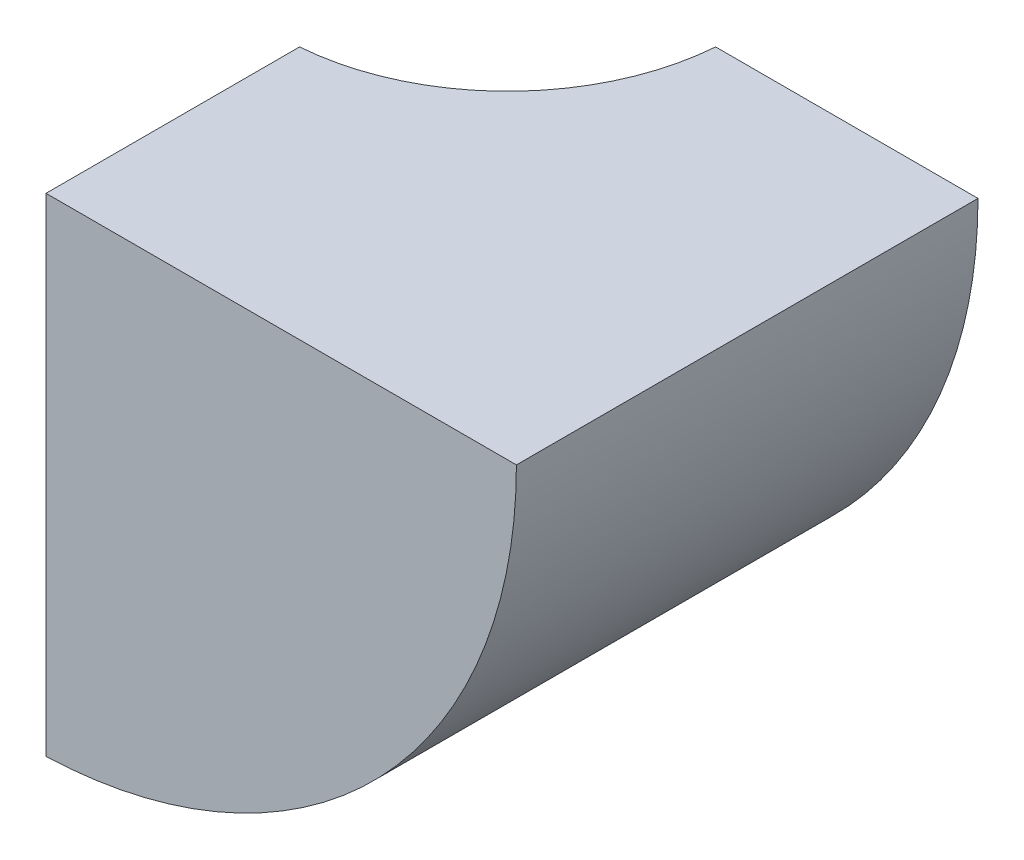
from build123d import *

# Parameters (mm, degrees)
SKETCH1_R           = 16.6
BOSS_EXTRUDE1_DEPTH = 16.3
CUT_EXTRUDE1_DEPTH  = 29.579888033
SKETCH3_R           = 7.7
CUT_EXTRUDE2_DEPTH  = 29.579888033
SKETCH4_W           = 0.6
SKETCH4_H           = 9.511954595
SKETCH4_W_2         = 10.341543893
SKETCH4_H_2         = 0.6
CUT_EXTRUDE3_DEPTH  = 29.579888207


with BuildPart() as part:
    # Sketch1 → Boss-Extrude1 (new body)
    with BuildSketch(Plane.XY):
        Circle(SKETCH1_R)
    extrude(amount=BOSS_EXTRUDE1_DEPTH)

    # Sketch2 → Cut-Extrude1 (cut, through all)
    with BuildSketch(Plane.XY.offset(16.3)):
        with BuildLine():
            Line((0, 0), (16.6, 0))
            ThreePointArc((16.6, 0), (-11.737972568, 11.737972568), (0, -16.6))
            Line((0, -16.6), (0, 0))
        make_face()
    extrude(amount=-CUT_EXTRUDE1_DEPTH, mode=Mode.SUBTRACT)

    # Sketch3 → Cut-Extrude2 (cut, through all)
    with BuildSketch(Plane(origin=(0, 0, 0), x_dir=(1, 0, 0), z_dir=(0, 1, 0))):
        Circle(SKETCH3_R)
    extrude(amount=-CUT_EXTRUDE2_DEPTH, mode=Mode.SUBTRACT)

    # Sketch4 → Cut-Extrude3 (cut, through all)
    with BuildSketch(Plane(origin=(0, 0, 0), x_dir=(1, 0, 0), z_dir=(0, 1, 0))):
        with Locations((0.3, -11.544022703)):
            Rectangle(SKETCH4_W, SKETCH4_H)
        with Locations((11.429228054, -0.3)):
            Rectangle(SKETCH4_W_2, SKETCH4_H_2)
    extrude(amount=-CUT_EXTRUDE3_DEPTH, mode=Mode.SUBTRACT)


solid = part.part
